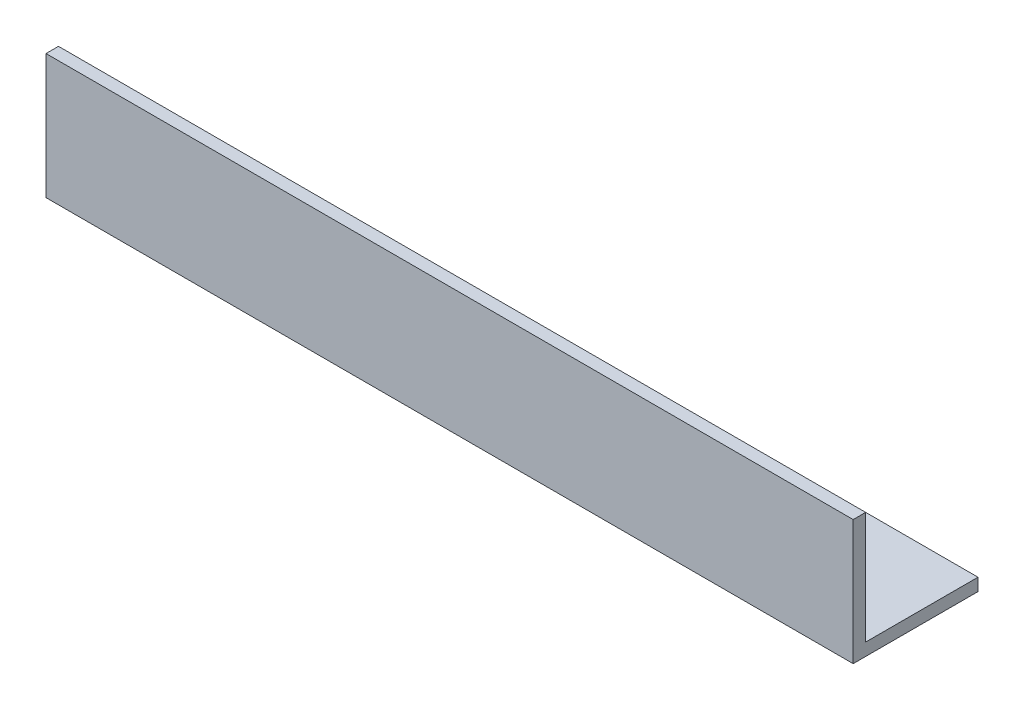
from build123d import *

# Parameters (mm, degrees)
EXTRUDE_1_DEPTH = 194


with BuildPart() as part:
    # Эскиз1 → Вытянуть-Тонкостенный1 (new body)
    with BuildSketch(Plane(origin=(0, 0, 0), x_dir=(0, 0, -1), z_dir=(1, 0, 0))):
        Polygon((0, 30), (0, 0), (30, 0), (30, 3), (3, 3), (3, 30), align=None)
    extrude(amount=EXTRUDE_1_DEPTH)


solid = part.part
